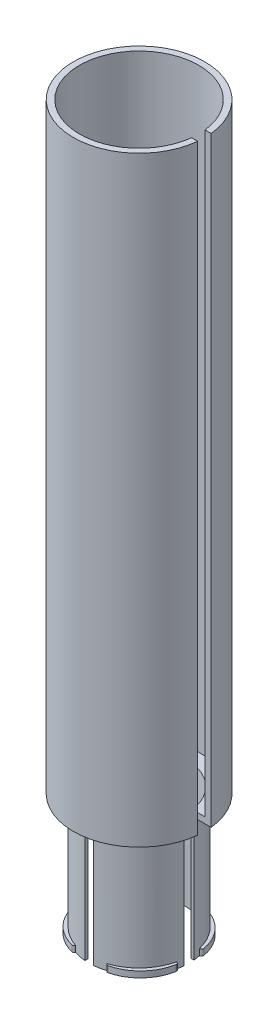
from build123d import *

# Parameters (mm, degrees)
SKETCH1_R           = 21.59
BOSS_EXTRUDE1_DEPTH = 200
SHELL1_T            = 2
CUT_EXTRUDE1_START  = 20
CUT_EXTRUDE1_DEPTH  = 5
SKETCH4_R           = 16.5
BOSS_EXTRUDE2_DEPTH = 40
SKETCH7_R           = 15.5
CUT_EXTRUDE4_DEPTH  = 62
SKETCH8_W           = 2.785852998
SKETCH8_H           = 5.87658936
SKETCH8_W_2         = 8.878050256
SKETCH8_H_2         = 3.207420782
SKETCH8_W_3         = 2.758641046
SKETCH8_H_3         = 8.505589864
CUT_EXTRUDE5_DEPTH  = 203.317216766
BOSS_EXTRUDE4_DEPTH = 2
SKETCH10_R          = 21.59
CUT_EXTRUDE7_DEPTH  = 2.5


with BuildPart() as part:
    # Sketch1 → Boss-Extrude1 (new body)
    with BuildSketch(Plane(origin=(0, 0, 0), x_dir=(1, 0, 0), z_dir=(0, 1, 0))):
        with Locations(Location((0, 0, 0), (0, 0, 270))):
            Circle(SKETCH1_R)
    extrude(amount=BOSS_EXTRUDE1_DEPTH)

    # Shell1 (no face opened: a closed hollow body)
    add(offset(amount=-SHELL1_T, mode=Mode.PRIVATE), mode=Mode.SUBTRACT)

    # Sketch2 → Cut-Extrude1 (cut, symmetric)
    with BuildSketch(Plane(origin=(0, 0, 0), x_dir=(0, 0, -1), z_dir=(1, 0, 0)).offset(CUT_EXTRUDE1_START)):
        Polygon((2.213988381, 104.269834735), (2.213988381, 0), (-2.213988381, 0), (-2.213988381, 104.269834735), (-2.213988381, 199.79439609), (2.213988381, 199.79439609), align=None)
    extrude(amount=CUT_EXTRUDE1_DEPTH, both=True, mode=Mode.SUBTRACT)

    # Sketch4 → Boss-Extrude2 (add)
    with BuildSketch(Plane.XZ):
        with Locations(Location((0, 0, 0), (0, 0, 7.711270357))):
            Circle(SKETCH4_R)
    extrude(amount=BOSS_EXTRUDE2_DEPTH)

    # Sketch7 → Cut-Extrude4 (cut)
    with BuildSketch(Plane(origin=(0, -40, 0), x_dir=(-1, 0, 0), z_dir=(0, -1, 0))):
        with Locations(Location((0, 0, 0), (0, 0, 90))):
            Circle(SKETCH7_R)
    extrude(amount=-CUT_EXTRUDE4_DEPTH, mode=Mode.SUBTRACT)

    # Sketch8 → Cut-Extrude5 (cut, through all)
    with BuildSketch(Plane(origin=(0, 0, 0), x_dir=(1, 0, 0), z_dir=(0, 1, 0))):
        with Locations((0, 20.108138302)):
            Rectangle(SKETCH8_W, SKETCH8_H)
        with Locations((18.709836445, -0.001004202)):
            Rectangle(SKETCH8_W_2, SKETCH8_H_2)
        with Locations((0.013605976, -18.452209414)):
            Rectangle(SKETCH8_W_3, SKETCH8_H_3)
        with Locations((-18.709836445, -0.001004202)):
            Rectangle(SKETCH8_W_2, SKETCH8_H_2)
    extrude(amount=-CUT_EXTRUDE5_DEPTH, mode=Mode.SUBTRACT)

    # Sketch9 → Boss-Extrude4 (add)
    with BuildSketch(Plane.XZ.offset(40)):
        with BuildLine():
            ThreePointArc((16.726333299, 4.561841417), (13.056013579, 11.944688127), (5.932226465, 16.095510881))
            ThreePointArc((5.932226465, 16.095510881), (5.137631387, 15.609709062), (5.623433206, 14.815113985))
            ThreePointArc((5.623433206, 14.815113985), (12.094357446, 11.044695365), (15.428308962, 4.338453169))
            ThreePointArc((15.428308962, 4.338453169), (16.189015254, 3.801135125), (16.726333299, 4.561841417))
        make_face()
        with BuildLine():
            ThreePointArc((16.726333299, -4.561841417), (13.056013579, -11.944688127), (5.932226465, -16.095510881))
            ThreePointArc((5.932226465, -16.095510881), (5.137631387, -15.609709062), (5.623433206, -14.815113985))
            ThreePointArc((5.623433206, -14.815113985), (12.094357446, -11.044695365), (15.428308962, -4.338453169))
            ThreePointArc((15.428308962, -4.338453169), (16.189015254, -3.801135125), (16.726333299, -4.561841417))
        make_face()
        with BuildLine():
            ThreePointArc((-16.726333299, -4.561841417), (-13.056013579, -11.944688127), (-5.932226465, -16.095510881))
            ThreePointArc((-5.932226465, -16.095510881), (-5.137631387, -15.609709062), (-5.623433206, -14.815113985))
            ThreePointArc((-5.623433206, -14.815113985), (-12.094357446, -11.044695365), (-15.428308962, -4.338453169))
            ThreePointArc((-15.428308962, -4.338453169), (-16.189015254, -3.801135125), (-16.726333299, -4.561841417))
        make_face()
        with BuildLine():
            ThreePointArc((-16.726333299, 4.561841417), (-13.056013579, 11.944688127), (-5.932226465, 16.095510881))
            ThreePointArc((-5.932226465, 16.095510881), (-5.137631387, 15.609709062), (-5.623433206, 14.815113985))
            ThreePointArc((-5.623433206, 14.815113985), (-12.094357446, 11.044695365), (-15.428308962, 4.338453169))
            ThreePointArc((-15.428308962, 4.338453169), (-16.189015254, 3.801135125), (-16.726333299, 4.561841417))
        make_face()
    extrude(amount=-BOSS_EXTRUDE4_DEPTH)

    # Sketch10 → Cut-Extrude7 (cut, symmetric)
    with BuildSketch(Plane(origin=(0, 200, 0), x_dir=(1, 0, 0), z_dir=(0, 1, 0))):
        Circle(SKETCH10_R)
    extrude(amount=CUT_EXTRUDE7_DEPTH, both=True, mode=Mode.SUBTRACT)


solid = part.part
